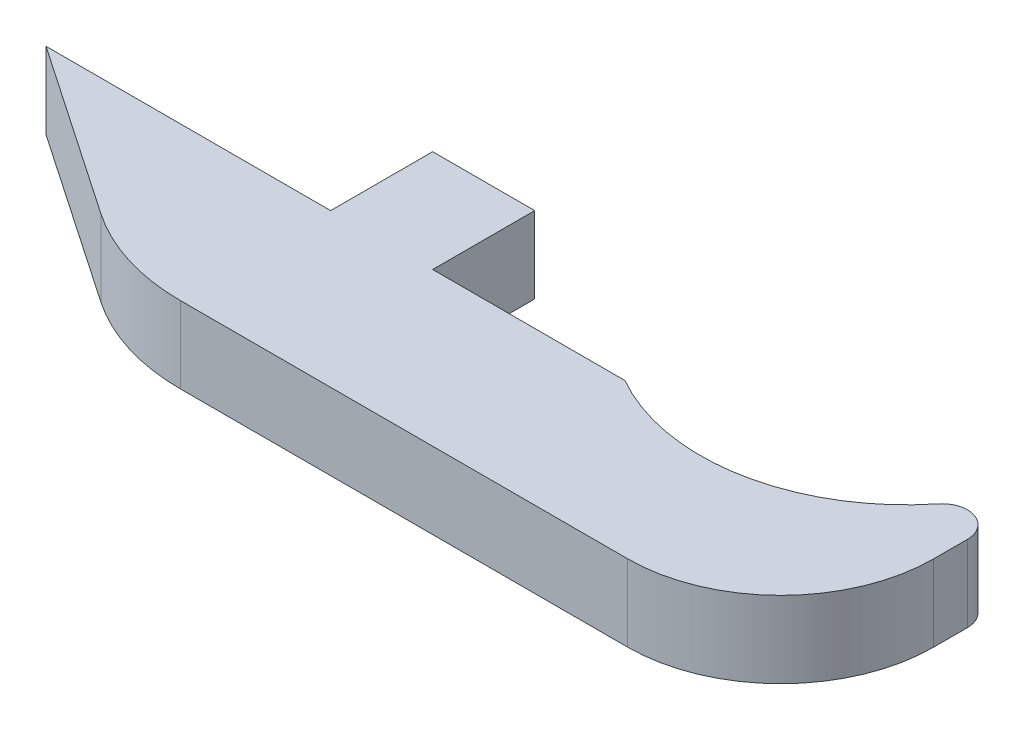
from build123d import *

# Parameters (mm, degrees)
BOSS_EXTRUDE1_DEPTH = 4.7625
FILLET1_R           = 9.525
FILLET2_R           = 1.5875
FILLET4_R           = 12.7
BOSS_EXTRUDE2_DEPTH = 4.7625


with BuildPart() as part:
    # Sketch1 → Boss-Extrude1 (new body)
    with BuildSketch(Plane(origin=(0, 0, 0), x_dir=(1, 0, 0), z_dir=(0, 1, 0))):
        with BuildLine():
            ThreePointArc((58.41999999999972, 11.1252), (52.02098311010975, 0.02506657124609291), (39.20849892630516, 3.1797e-13))
            Line((39.20849892630509, 2.8e-15), (3.17499999999972, 2.3e-16))
            Line((3.174999999999723, -3.02e-15), (17.14499999999994, -9.525))
            Line((17.14499999999994, -9.525), (58.41999999999994, -9.525))
            Line((58.41999999999994, -9.525000000000002), (58.419999999999725, 11.125200000000003))
        make_face()
    extrude(amount=BOSS_EXTRUDE1_DEPTH)

    # Fillet1
    fillet1_edges = [part.edges().sort_by_distance(p)[0] for p in [
        (58.41999999999994, 2.38125, 9.525000000000002),
    ]]
    fillet(fillet1_edges, radius=FILLET1_R)

    # Fillet2
    fillet2_edges = [part.edges().sort_by_distance(p)[0] for p in [
        (58.41999999999972, 2.38125, -11.125200000000001),
    ]]
    fillet(fillet2_edges, radius=FILLET2_R)

    # Fillet4
    fillet4_edges = [part.edges().sort_by_distance(p)[0] for p in [
        (17.14499999999994, 2.38125, 9.525),
    ]]
    fillet(fillet4_edges, radius=FILLET4_R)

    # Sketch2 → Boss-Extrude2 (add)
    with BuildSketch(Plane.XZ):
        Polygon((20.889500000001707, -6.350000000002216), (27.23950000000171, -6.350000000002216), (27.23950000000171, 5.33e-15), (20.889500000001707, 4.43e-15), align=None)
    extrude(amount=-BOSS_EXTRUDE2_DEPTH)


solid = part.part
